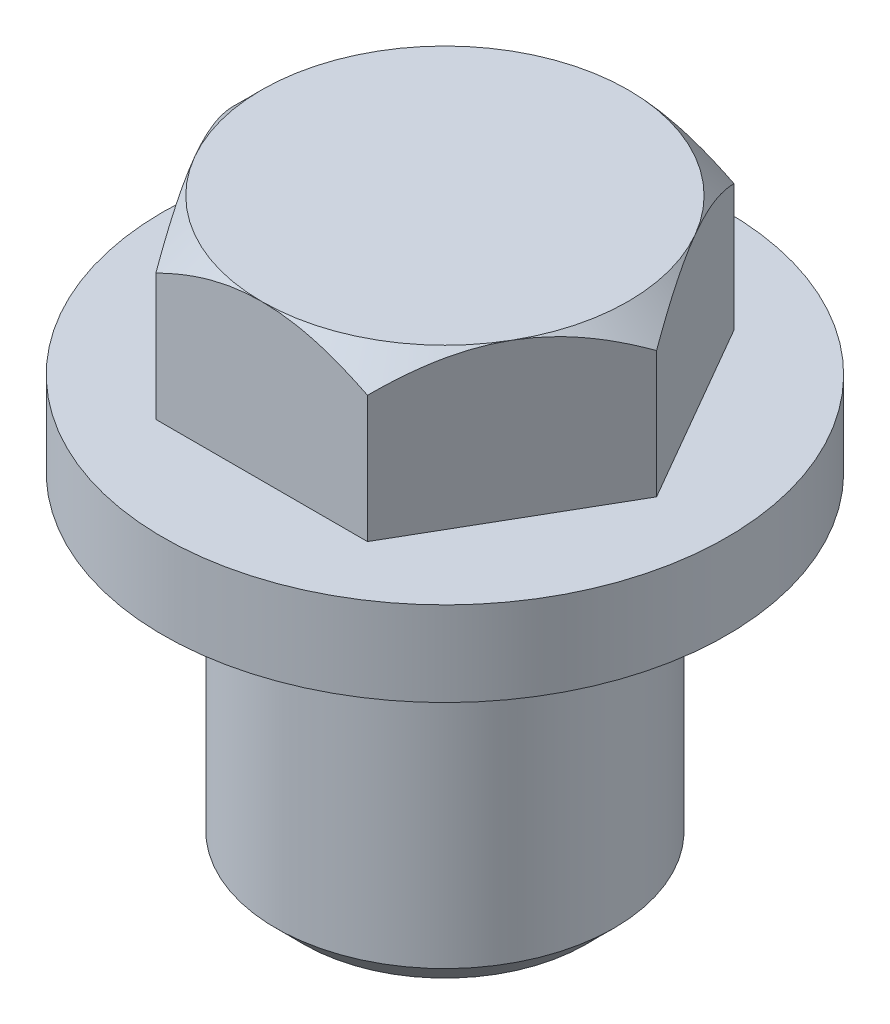
from build123d import *

# Parameters (mm, degrees)
BOSS_EXTRUDE1_DEPTH = 5.5
SKETCH3_OUTSIDE_W   = 39.986
SKETCH3_OUTSIDE_H   = 39.986
SKETCH3_OUTSIDE_R   = 6.5
CUT_EXTRUDE1_DEPTH  = 5.5
CUT_EXTRUDE1_DRAFT  = -45


with BuildPart() as part:
    # Sketch1 → Revolve1 (revolve)
    with BuildSketch(Plane.XY):
        with BuildLine():
            Line((0, 0), (-5, 0))
            Line((-5, 0), (-6, 1))
            Line((-6, 1), (-6, 10))
            ThreePointArc((-6, 10), (-5, 11), (-6, 12))
            Line((-6, 12), (-10, 12))
            Line((-10, 12), (-10, 15))
            Line((-10, 15), (0, 15))
            Line((0, 15), (0, 0))
        make_face()
    revolve(axis=Axis((0, 15, 0), (0, -1, 0)))

    # Sketch2 → Boss-Extrude1 (add)
    with BuildSketch(Plane(origin=(0, 15, 0), x_dir=(1, 0, 0), z_dir=(0, 1, 0))):
        Polygon((-3.75277675, 6.5), (-7.505553499, 0), (-3.75277675, -6.5), (3.75277675, -6.5), (7.505553499, 0), (3.75277675, 6.5), align=None)
    extrude(amount=BOSS_EXTRUDE1_DEPTH)


with BuildPart() as cut_extrude1_tool:
    # Sketch3 outside → Cut-Extrude1 (with draft: the straight prism first)
    with BuildSketch(Plane(origin=(0, 20.5, 0), x_dir=(1, 0, 0), z_dir=(0, 1, 0))):
        Rectangle(SKETCH3_OUTSIDE_W, SKETCH3_OUTSIDE_H)
        Circle(SKETCH3_OUTSIDE_R, mode=Mode.SUBTRACT)
    extrude(amount=-CUT_EXTRUDE1_DEPTH)
    # Cut-Extrude1: the draft: its side faces are tilted about the plane it starts from
    cut_extrude1_sides = [cut_extrude1_tool.faces().sort_by_distance(p)[0] for p in [
        (0, 17.75, 19.993),
        (19.993, 17.75, 0),
        (0, 17.75, -19.993),
        (-19.993, 17.75, 0),
        (-6.5, 17.75, 0),
    ]]
    draft(cut_extrude1_sides, Plane(origin=(0, 20.5, 0), x_dir=(1, 0, 0), z_dir=(0, 1, 0)), CUT_EXTRUDE1_DRAFT)


with BuildPart() as part_1:
    add(part.part)

    # Cut-Extrude1: cut by cut_extrude1_tool
    add(cut_extrude1_tool.part, mode=Mode.SUBTRACT)


solid = part_1.part
